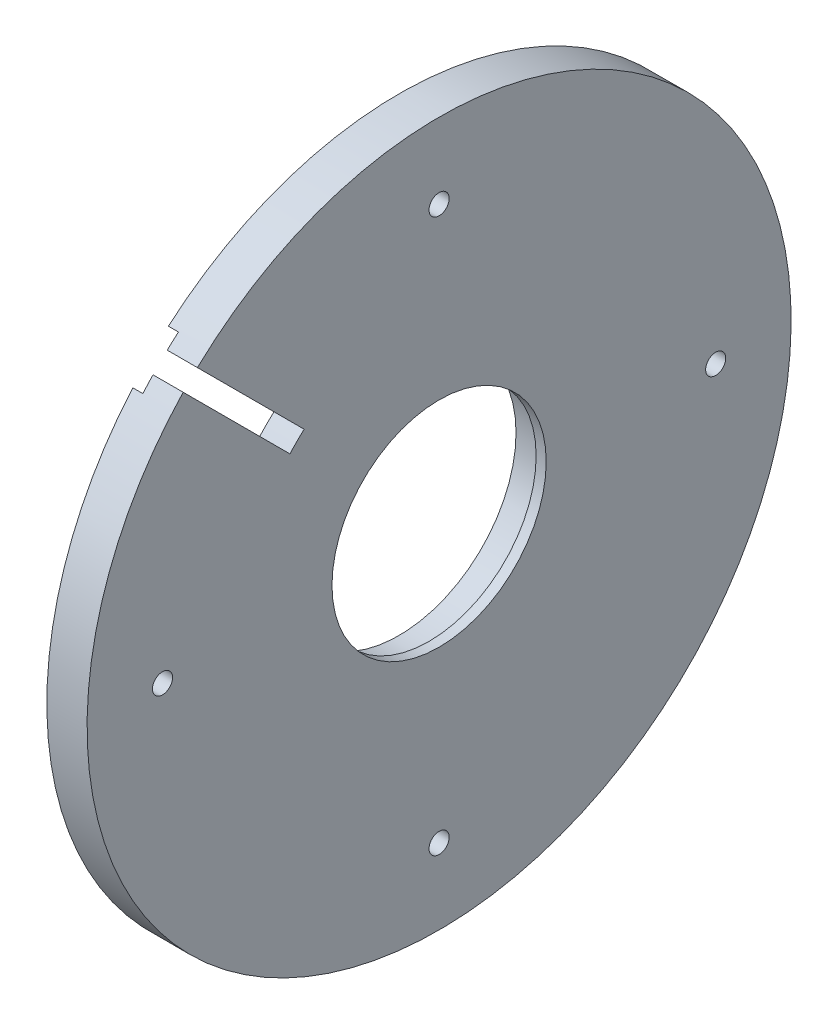
from build123d import *

# Parameters (mm, degrees)
SKETCH1_R           = 35
SKETCH1_R_2         = 11.65
BOSS_EXTRUDE1_DEPTH = 4
CUT_EXTRUDE1_DEPTH  = 10
SKETCH6_R           = 1
CUT_EXTRUDE4_DEPTH  = 10
BOSS_EXTRUDE3_START = 1
SKETCH7_R           = 11.65
SKETCH7_R_2         = 10.65
BOSS_EXTRUDE3_DEPTH = 1
SKETCH8_R           = 11.65
SKETCH8_R_2         = 11.15
CUT_EXTRUDE5_DEPTH  = 0.25
FILLET1_R           = 0.1
CUT_EXTRUDE6_DEPTH  = 1


with BuildPart() as part:
    # Sketch1 → Boss-Extrude1 (new body)
    with BuildSketch(Plane(origin=(0, 0, 0), x_dir=(0, -0.16775650988153862, -0.9858284604292805), z_dir=(1, 0, 0))):
        with Locations(Location((-28.542888787, 18.957113921, 0), (0, 0, 9.65740334))):
            Circle(SKETCH1_R)
        with Locations(Location((-28.542888787, 18.957113921, 0), (0, 0, 9.65740334))):
            Circle(SKETCH1_R_2, mode=Mode.SUBTRACT)
    extrude(amount=BOSS_EXTRUDE1_DEPTH)

    # Sketch2 → Cut-Extrude1 (cut)
    with BuildSketch(Plane.ZY):
        with BuildLine():
            Line((38.375552951, 38.308271509), (48.999843401, 48.932561958))
            Line((48.999843401, 48.932561958), (51.312030188, 52.930544456))
            Line((51.312030188, 52.930544456), (54.007279042, 51.111570475))
            Line((54.007279042, 51.111570475), (50.414056963, 47.518348396))
            Line((50.414056963, 47.518348396), (39.789766514, 36.894057946))
            ThreePointArc((39.789766514, 36.894057946), (39.100348464, 37.618853459), (38.375552951, 38.308271509))
        make_face()
    extrude(amount=-CUT_EXTRUDE1_DEPTH, mode=Mode.SUBTRACT)

    # Sketch6 → Cut-Extrude4 (cut)
    with BuildSketch(Plane(origin=(4, 0, 0), x_dir=(0, 0, -1), z_dir=(1, 0, 0))):
        with Locations((-24.958212841, -4.023282164)):
            Circle(SKETCH6_R)
        with Locations((2.541787159, 23.476717836)):
            Circle(SKETCH6_R)
        with Locations((-52.458212841, 23.476717836)):
            Circle(SKETCH6_R)
        with Locations((-24.958212841, 50.976717836)):
            Circle(SKETCH6_R)
    extrude(amount=-CUT_EXTRUDE4_DEPTH, mode=Mode.SUBTRACT)

    # Sketch7 → Boss-Extrude3 (add)
    with BuildSketch(Plane.ZY.offset(-4).offset(BOSS_EXTRUDE3_START)):
        with Locations((24.958212841, 23.476717836)):
            Circle(SKETCH7_R)
        with Locations((24.958212841, 23.476717836)):
            Circle(SKETCH7_R_2, mode=Mode.SUBTRACT)
    extrude(amount=-BOSS_EXTRUDE3_DEPTH)

    # Sketch8 → Cut-Extrude5 (cut)
    with BuildSketch(Plane.ZY.offset(-3)):
        with Locations((24.958212841, 23.476717836)):
            Circle(SKETCH8_R)
        with Locations((24.958212841, 23.476717836)):
            Circle(SKETCH8_R_2, mode=Mode.SUBTRACT)
    extrude(amount=-CUT_EXTRUDE5_DEPTH, mode=Mode.SUBTRACT)

    # Fillet1
    fillet1_edges = [part.edges().sort_by_distance(p)[0] for p in [
        (3.25, 23.476717836, 13.808212841),
    ]]
    fillet(fillet1_edges, radius=FILLET1_R)

    # Sketch9 → Cut-Extrude6 (cut)
    with BuildSketch(Plane.ZY):
        Polygon((36.254232608, 38.308271509), (48.989739813, 51.043778714), (52.525273719, 47.508244808), (39.789766514, 34.772737603), (39.082659732, 34.065630822), (35.547125827, 37.601164728), align=None)
        Polygon((48.989739813, 48.922458371), (50.403953376, 47.508244808), (40.402946038, 37.507237471), (38.988732476, 38.921451033), align=None, mode=Mode.SUBTRACT)
    extrude(amount=-CUT_EXTRUDE6_DEPTH, mode=Mode.SUBTRACT)


solid = part.part
